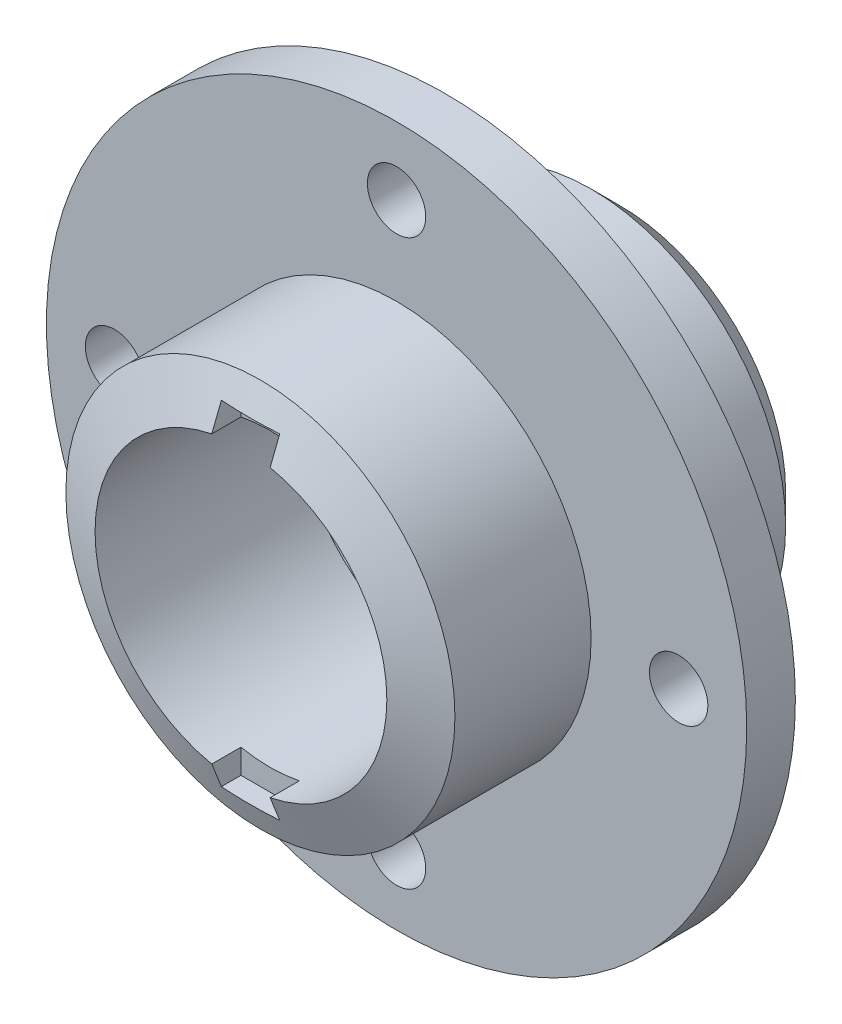
from build123d import *

# Parameters (mm, degrees)
CUT_EXTRUDE1_DEPTH      = 111.145358504
CUT_EXTRUDE1_DEPTH_BACK = 111.145358504
SKETCH2_R               = 6
SKETCH5_W               = 12
SKETCH5_H               = 8.82137068
CUT_EXTRUDE3_DEPTH      = 6


with BuildPart() as part:
    # Sketch1 → Revolve1 (revolve)
    with BuildSketch(Plane(origin=(0, 0, 0), x_dir=(1, 0, 0), z_dir=(0, 1, 0))):
        Polygon((24, 78), (24, 72), (34, 72), (34, 42), (30, 42), (30, 0), (40, 4), (40, 32), (72, 32), (72, 42), (40, 42), (40, 72), (34, 78), align=None)
    revolve(axis=Axis((0, 0, 0), (0, 0, -1)))

    # Sketch2 → Cut-Extrude1 (cut, two sides: drawn at the far end of the back side and taken through both)
    with BuildSketch(Plane(origin=(0, 0, -42), x_dir=(-1, 0, 0), z_dir=(0, 0, -1)).offset(-CUT_EXTRUDE1_DEPTH_BACK)):
        with Locations((0, 58)):
            Circle(SKETCH2_R)
        with Locations((58, 0)):
            Circle(SKETCH2_R)
        with Locations((0, -58)):
            Circle(SKETCH2_R)
        with Locations((-58, 0)):
            Circle(SKETCH2_R)
    extrude(amount=CUT_EXTRUDE1_DEPTH + CUT_EXTRUDE1_DEPTH_BACK, mode=Mode.SUBTRACT)

    # Sketch5 → Cut-Extrude3 (cut)
    with BuildSketch(Plane.XY):
        with Locations((0, 30)):
            Rectangle(SKETCH5_W, SKETCH5_H)
        with Locations((0, -30)):
            Rectangle(SKETCH5_W, SKETCH5_H)
    extrude(amount=-CUT_EXTRUDE3_DEPTH, mode=Mode.SUBTRACT)


solid = part.part
